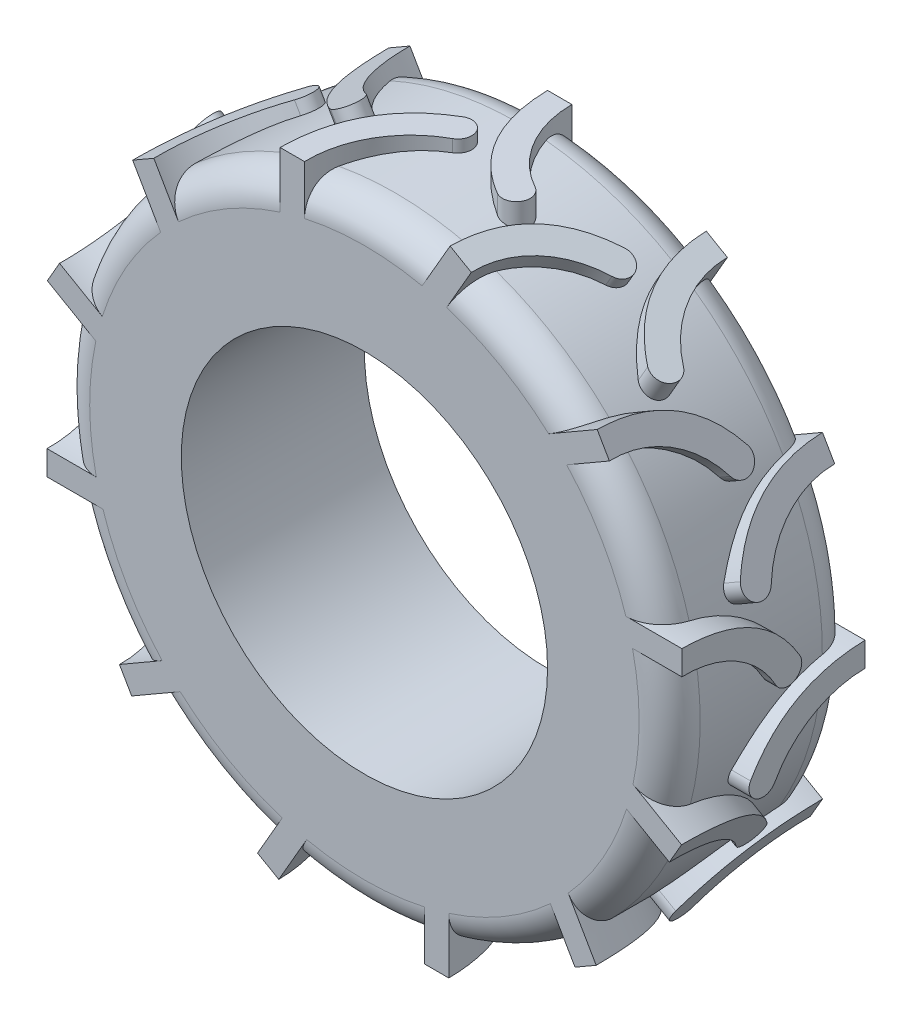
from build123d import *

# Parameters (mm, degrees)
SKETCH2_R           = 50
SKETCH2_R_2         = 30
BOSS_EXTRUDE1_DEPTH = 30
FILLET1_R           = 5
BOSS_EXTRUDE5_REACH = 119.49
CIRPATTERN1_COUNT   = 12


with BuildPart() as part:
    # Sketch2 → Boss-Extrude1 (new body)
    with BuildSketch(Plane.XY):
        Circle(SKETCH2_R)
        Circle(SKETCH2_R_2, mode=Mode.SUBTRACT)
    extrude(amount=BOSS_EXTRUDE1_DEPTH)

    # Fillet1
    fillet1_edges = [part.edges().sort_by_distance(p)[0] for p in [
        (-50, 0, 0),
        (-50, 0, 30),
    ]]
    fillet(fillet1_edges, radius=FILLET1_R)

    # Sketch7 → Boss-Extrude5 (add, up to next)
    with BuildSketch(Plane(origin=(52, 0, 0), x_dir=(0, 0, -1), z_dir=(1, 0, 0)), mode=Mode.PRIVATE) as boss_extrude5_sk1:
        with BuildLine():
            Line((0, 0.010521946), (0, -3.989478054))
            ThreePointArc((0, -3.989478054), (-8.569114859, -6.333844577), (-14.751363522, -12.713937472))
            ThreePointArc((-14.751363522, -12.713937472), (-17.806594139, -13.621815028), (-18.751363522, -10.577790292))
            add(Edge.make_bspline(
                [(-18.751363522, -10.577790292), (-12.827348563, -0.281615224), (0, 0.010521946)],
                knots=[0, 0, 0, 1, 1, 1], degree=2))
        make_face()
    boss_extrude5_tool1 = extrude(boss_extrude5_sk1.sketch, amount=-BOSS_EXTRUDE5_REACH, mode=Mode.PRIVATE) - part.part
    # Sketch7 → Boss-Extrude5 (add, up to next)
    with BuildSketch(Plane(origin=(52, 0, 0), x_dir=(0, 0, -1), z_dir=(1, 0, 0)), mode=Mode.PRIVATE) as boss_extrude5_sk2:
        with BuildLine():
            Line((-30, 13.816290587), (-30, 9.809472111))
            ThreePointArc((-30, 9.809472111), (-21.063467548, 7.558796912), (-14.62222255, 0.968082688))
            ThreePointArc((-14.62222255, 0.968082688), (-11.562768396, 0.052831443), (-10.62222255, 3.104604382))
            add(Edge.make_bspline(
                [(-10.62222255, 3.104604382), (-16.745092173, 13.658059174), (-30, 13.816290587)],
                knots=[0, 0, 0, 1, 1, 1], degree=2))
        make_face()
    boss_extrude5_tool2 = extrude(boss_extrude5_sk2.sketch, amount=-BOSS_EXTRUDE5_REACH, mode=Mode.PRIVATE) - part.part
    boss_extrude5_1 = boss_extrude5_tool1.solids().sort_by_distance((52, -5.945241, 10.174254))[0]
    add(boss_extrude5_1)
    boss_extrude5_2 = boss_extrude5_tool2.solids().sort_by_distance((52, 7.87248, 19.463115))[0]
    add(boss_extrude5_2)
    boss_extrude5 = boss_extrude5_1 + boss_extrude5_2  # Boss-Extrude5 as one shape, for the pattern or mirror that repeats it

    # CirPattern1: Boss-Extrude5 ×12 about axis
    cirpattern1_axis = Axis((0, 0, 30), (0, 0, -1))
    for i in range(1, CIRPATTERN1_COUNT):
        add(boss_extrude5.rotate(cirpattern1_axis, i * 360 / CIRPATTERN1_COUNT))


solid = part.part
